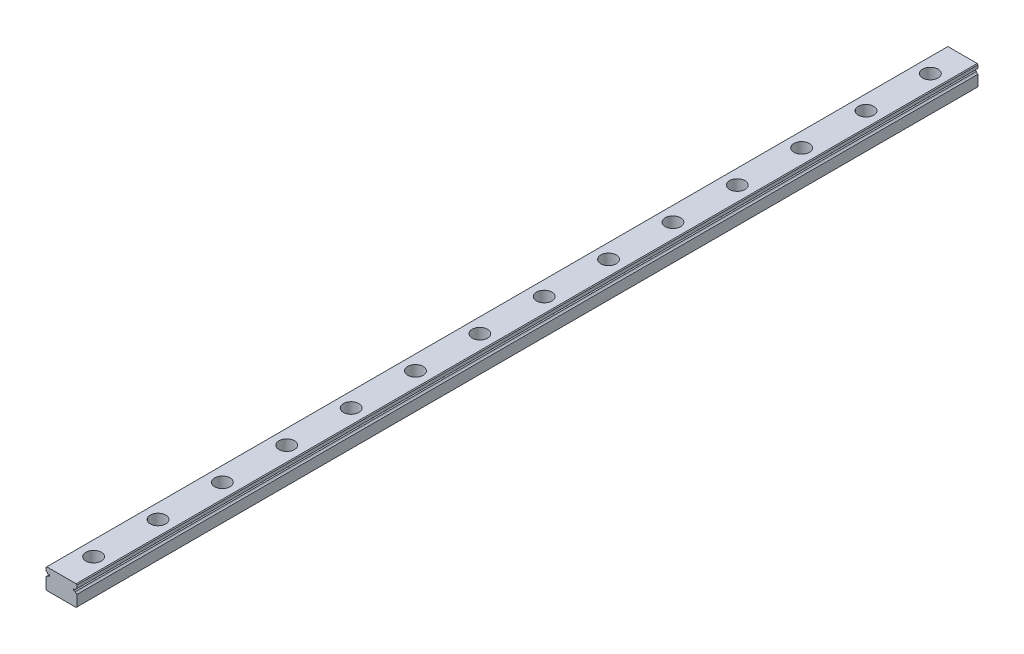
from build123d import *

# Parameters (mm, degrees)
EXTRUSION1_DEPTH       = 350
SKETCH_2_R             = 3
SKETCH_2_R_2           = 1.75
CUT_EXTRUDE_1_DEPTH    = 4.5
SKETCH_2_2_R           = 1.75
CUT_EXTRUDE_2_DEPTH    = 351.142828
PATTERN_LINEAR_1_COUNT = 14
PATTERN_LINEAR_1_PITCH = 25


with BuildPart() as part:
    # Эскиз1 → Extrusion1 (new body)
    with BuildSketch(Plane.XY):
        with BuildLine():
            Line((-6, 3.7), (-5.7, 4))
            Line((-5.7, 4), (5.7, 4))
            Line((5.7, 4), (6, 3.7))
            Line((6, 3.7), (6, 2.451013544))
            ThreePointArc((6, 2.451013544), (5.597935912, 2.202976267), (5.354599002, 1.798050138))
            Line((5.354599002, 1.798050138), (4.643514056, 1.798050138))
            Line((4.643514056, 1.798050138), (4.643514056, 1.201949862))
            Line((4.643514056, 1.201949862), (5.354599002, 1.201949862))
            ThreePointArc((5.354599002, 1.201949862), (5.597935912, 0.797023733), (6, 0.548986456))
            Line((6, 0.548986456), (6, -3.7))
            Line((6, -3.7), (5.7, -4))
            Line((5.7, -4), (-5.7, -4))
            Line((-5.7, -4), (-6, -3.7))
            Line((-6, -3.7), (-6, 0.548986456))
            ThreePointArc((-6, 0.548986456), (-5.597935912, 0.797023733), (-5.354599002, 1.201949862))
            Line((-5.354599002, 1.201949862), (-4.643514056, 1.201949862))
            Line((-4.643514056, 1.201949862), (-4.643514056, 1.798050138))
            Line((-4.643514056, 1.798050138), (-5.354599002, 1.798050138))
            ThreePointArc((-5.354599002, 1.798050138), (-5.597935912, 2.202976267), (-6, 2.451013544))
            Line((-6, 2.451013544), (-6, 3.7))
        make_face()
    extrude(amount=EXTRUSION1_DEPTH)

    # Эскиз2 → Вырез-Вытянуть1 (cut)
    with BuildSketch(Plane(origin=(0, 4, 0), x_dir=(1, 0, 0), z_dir=(0, 1, 0))):
        with Locations((0, -12.5)):
            Circle(SKETCH_2_R)
        with Locations((0, -12.5)):
            Circle(SKETCH_2_R_2, mode=Mode.SUBTRACT)
    cut_extrude_1 = extrude(amount=-CUT_EXTRUDE_1_DEPTH, mode=Mode.SUBTRACT)

    # Эскиз2<2> → Вырез-Вытянуть2 (cut, through all)
    with BuildSketch(Plane(origin=(0, 4, 0), x_dir=(1, 0, 0), z_dir=(0, 1, 0))):
        with Locations((0, -12.5)):
            Circle(SKETCH_2_2_R)
    cut_extrude_2 = extrude(amount=-CUT_EXTRUDE_2_DEPTH, mode=Mode.SUBTRACT)

    # Линейный массив1: Вырез-Вытянуть1, Вырез-Вытянуть2 ×14
    with Locations(*[(0, 0, i * PATTERN_LINEAR_1_PITCH) for i in range(1, PATTERN_LINEAR_1_COUNT)]):
        add(cut_extrude_1, mode=Mode.SUBTRACT)
        add(cut_extrude_2, mode=Mode.SUBTRACT)


solid = part.part
